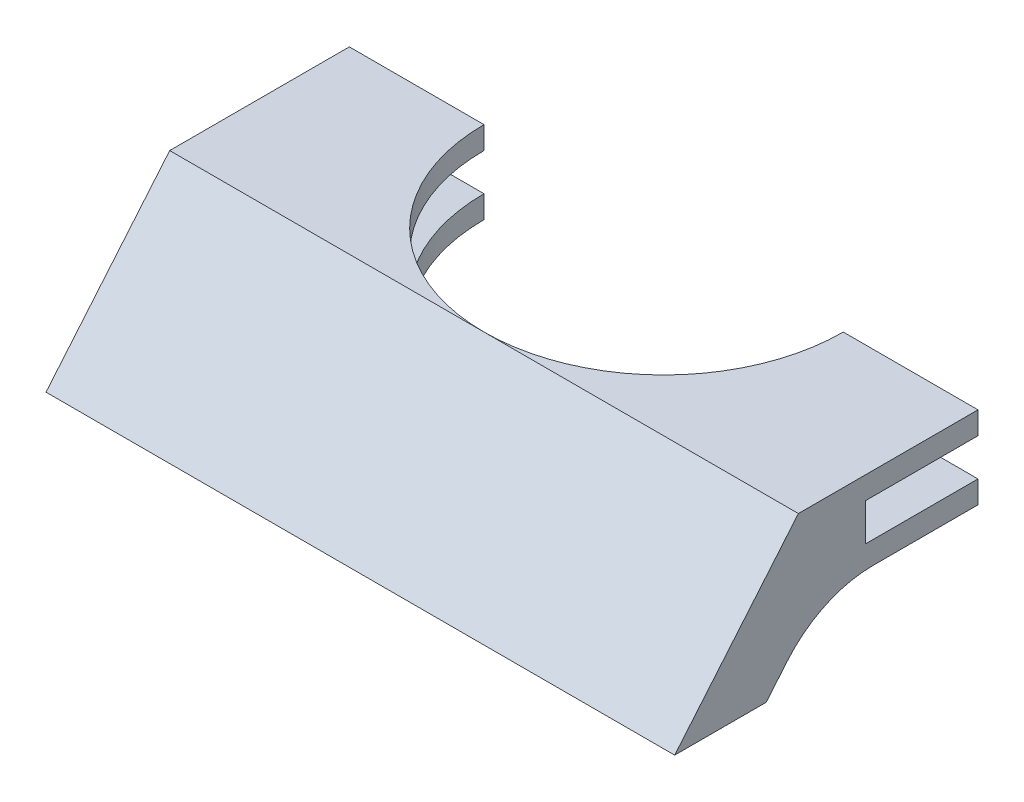
from build123d import *

# Parameters (mm, degrees)
BOSS_EXTRUDE1_DEPTH = 56
FILLET1_R           = 10
SKETCH15_R          = 16
CUT_EXTRUDE1_DEPTH  = 73.567889266


with BuildPart() as part:
    # Sketch1 → Boss-Extrude1 (new body)
    with BuildSketch(Plane(origin=(0, 0, 0), x_dir=(0, 0, -1), z_dir=(1, 0, 0))):
        Polygon((44.245922439, 12.13), (34.245922439, 12.13), (34.245922439, 8.8), (44.245922439, 8.8), (44.245922439, 6.8), (30.245922439, 6.8), (25.379144578, 1), (17.228544282, 1), (28.245922439, 14.13), (44.245922439, 14.13), align=None)
    extrude(amount=BOSS_EXTRUDE1_DEPTH)

    # Fillet1
    fillet1_edges = [part.edges().sort_by_distance(p)[0] for p in [
        (28, 6.8, -30.245922439),
    ]]
    fillet(fillet1_edges, radius=FILLET1_R)

    # Sketch15 → Cut-Extrude1 (cut, through all)
    with BuildSketch(Plane(origin=(0, 14.13, 0), x_dir=(1, 0, 0), z_dir=(0, 1, 0))):
        with Locations((28, 44.245922439)):
            Circle(SKETCH15_R)
    extrude(amount=-CUT_EXTRUDE1_DEPTH, mode=Mode.SUBTRACT)


solid = part.part
